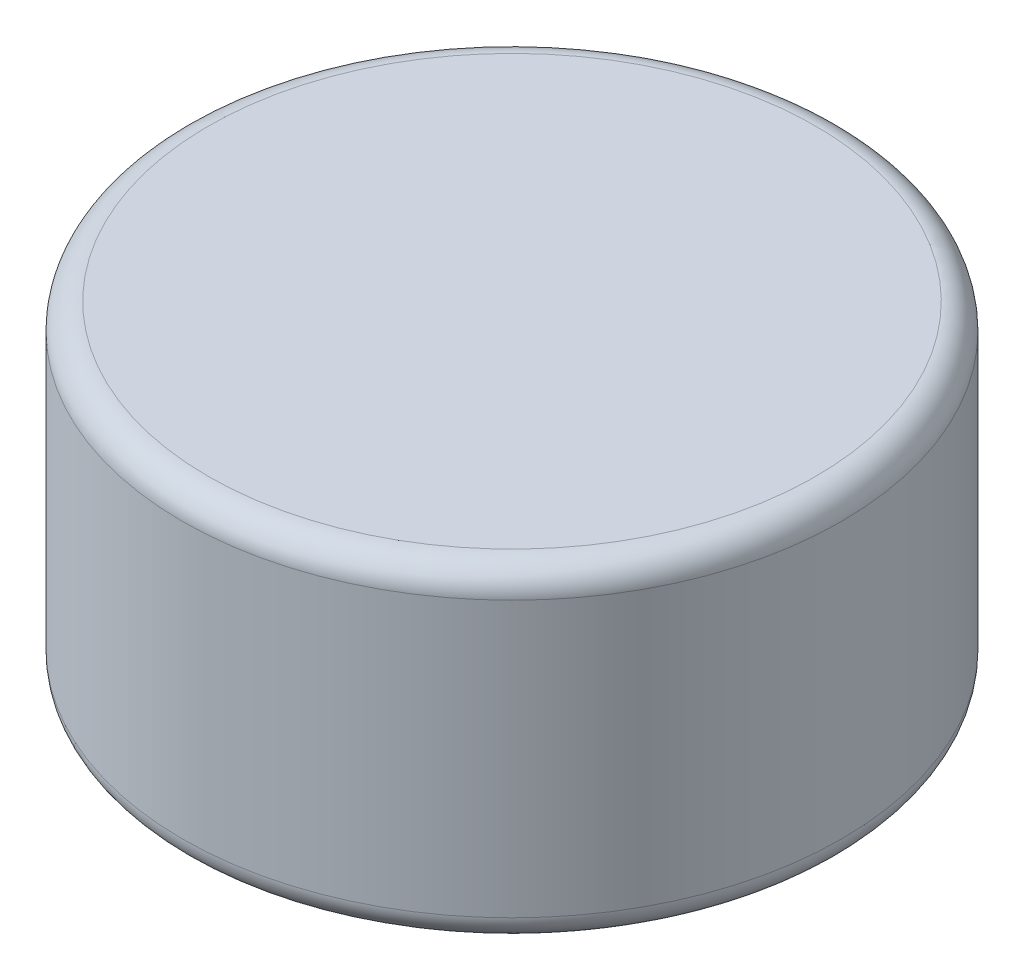
from build123d import *

# Parameters (mm, degrees)
SKETCH1_R           = 6.35
BOSS_EXTRUDE1_DEPTH = 6.3
FILLET1_R           = 0.5


with BuildPart() as part:
    # Sketch1 → Boss-Extrude1 (new body)
    with BuildSketch(Plane(origin=(0, 0, 0), x_dir=(1, 0, 0), z_dir=(0, 1, 0))):
        with Locations(Location((0, 0, 0), (0, 0, 270))):
            Circle(SKETCH1_R)
    extrude(amount=BOSS_EXTRUDE1_DEPTH)

    # Fillet1
    fillet1_edges = [part.edges().sort_by_distance(p)[0] for p in [
        (0, 0, -6.35),
        (0, 6.3, -6.35),
    ]]
    fillet(fillet1_edges, radius=FILLET1_R)


solid = part.part
